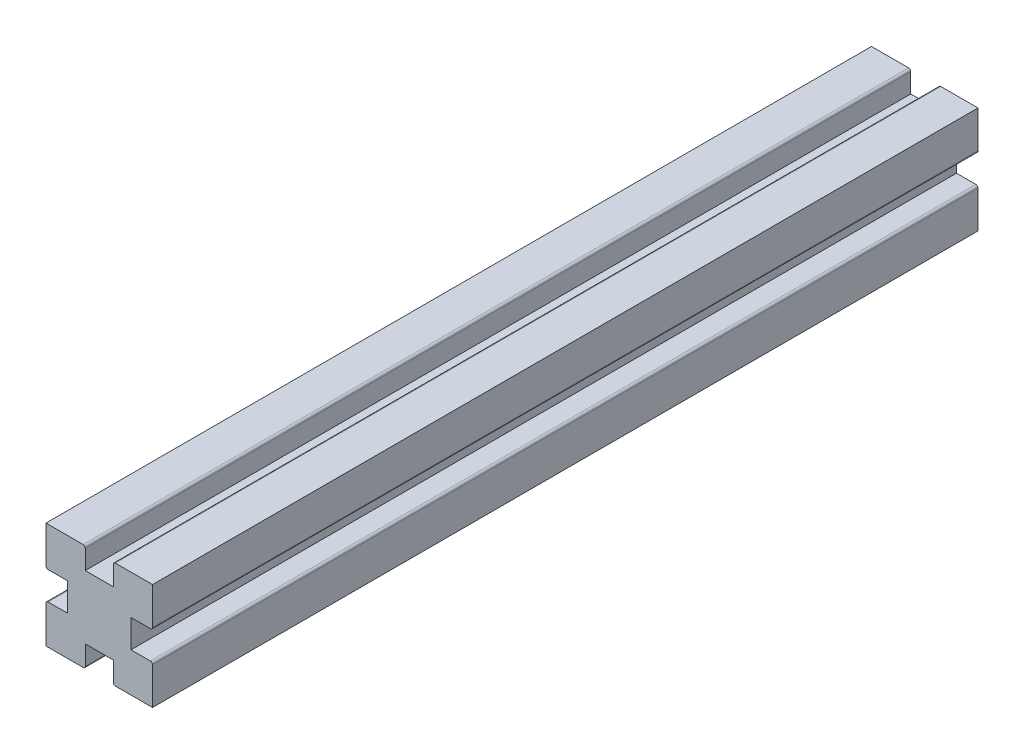
from build123d import *

# Parameters (mm, degrees)
BOSS_EXTRUDE1_DEPTH = 196.85
FILLET1_R           = 0.5


with BuildPart() as part:
    # Sketch1 → Boss-Extrude1 (new body)
    with BuildSketch(Plane.XY):
        Polygon((7.568163265, 3.34), (12.7, 3.34), (12.7, 12.7), (3.34, 12.7), (3.34, 7.568163265), (-3.34, 7.568163265), (-3.34, 12.7), (-12.7, 12.7), (-12.7, 3.34), (-7.568163265, 3.34), (-7.568163265, -3.34), (-12.7, -3.34), (-12.7, -12.7), (-3.34, -12.7), (-3.34, -7.568163265), (3.34, -7.568163265), (3.34, -12.7), (12.7, -12.7), (12.7, -3.34), (7.568163265, -3.34), align=None)
    extrude(amount=BOSS_EXTRUDE1_DEPTH)

    # Fillet1
    fillet1_edges = [part.edges().sort_by_distance(p)[0] for p in [
        (-12.7, 3.34, 98.425),
        (-3.34, 12.7, 98.425),
        (3.34, 12.7, 98.425),
        (12.7, 3.34, 98.425),
        (12.7, -3.34, 98.425),
        (3.34, -12.7, 98.425),
        (-3.34, -12.7, 98.425),
        (-12.7, -3.34, 98.425),
    ]]
    fillet(fillet1_edges, radius=FILLET1_R)


solid = part.part
